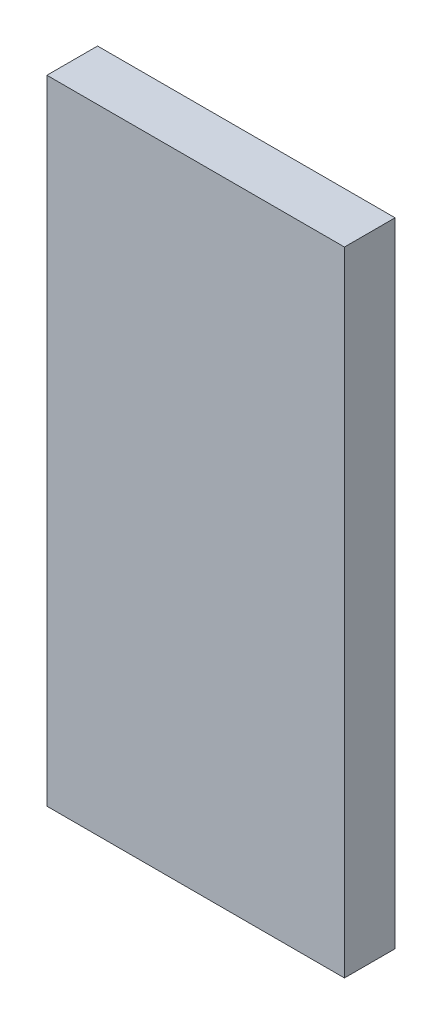
from build123d import *

# Parameters (mm, degrees)
SKETCH_1_W      = 94
SKETCH_1_H      = 200
EXTRUDE_1_DEPTH = 16


with BuildPart() as part:
    # 草图1 → 凸台-拉伸1 (new body)
    with BuildSketch(Plane.XY):
        Rectangle(SKETCH_1_W, SKETCH_1_H)
    extrude(amount=EXTRUDE_1_DEPTH)


solid = part.part
